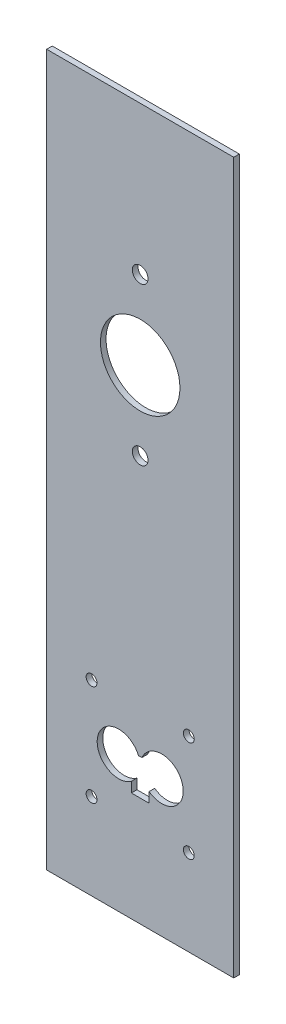
from build123d import *

# Parameters (mm, degrees)
SKETCH1_W           = 100
SKETCH1_H           = 380
BOSS_EXTRUDE1_DEPTH = 3
SKETCH1_4_R         = 2.9
SKETCH1_4_R_2       = 4.2
SKETCH1_4_R_3       = 21.25
CUT_EXTRUDE1_DEPTH  = 10


with BuildPart() as part:
    # Sketch1 → Boss-Extrude1 (new body)
    with BuildSketch(Plane.XY):
        with Locations((50, 190)):
            Rectangle(SKETCH1_W, SKETCH1_H)
    extrude(amount=-BOSS_EXTRUDE1_DEPTH)

    # Sketch1<4> → Cut-Extrude1 (cut)
    with BuildSketch(Plane.XY):
        with Locations((24, 100)):
            Circle(SKETCH1_4_R)
        with Locations((76, 100)):
            Circle(SKETCH1_4_R)
        with Locations((24, 46)):
            Circle(SKETCH1_4_R)
        with BuildLine():
            Line((54.75, 58.3), (54.75, 63.689387775))
            ThreePointArc((54.75, 63.689387775), (72.581133525, 76.075464159), (50.916994756, 77.5))
            Line((50.916994756, 77.5), (49.083005244, 77.5))
            ThreePointArc((49.083005244, 77.5), (27.418866475, 76.075464159), (45.25, 63.689387775))
            Line((45.25, 63.689387775), (45.25, 58.3))
            Line((45.25, 58.3), (50, 58.3))
            Line((50, 58.3), (54.75, 58.3))
        make_face()
        with Locations((50, 300.75)):
            Circle(SKETCH1_4_R_2)
        with Locations((50, 258.75)):
            Circle(SKETCH1_4_R_3)
        with Locations((50, 216.75)):
            Circle(SKETCH1_4_R_2)
        with Locations((76, 46)):
            Circle(SKETCH1_4_R)
    extrude(amount=-CUT_EXTRUDE1_DEPTH, mode=Mode.SUBTRACT)


solid = part.part
